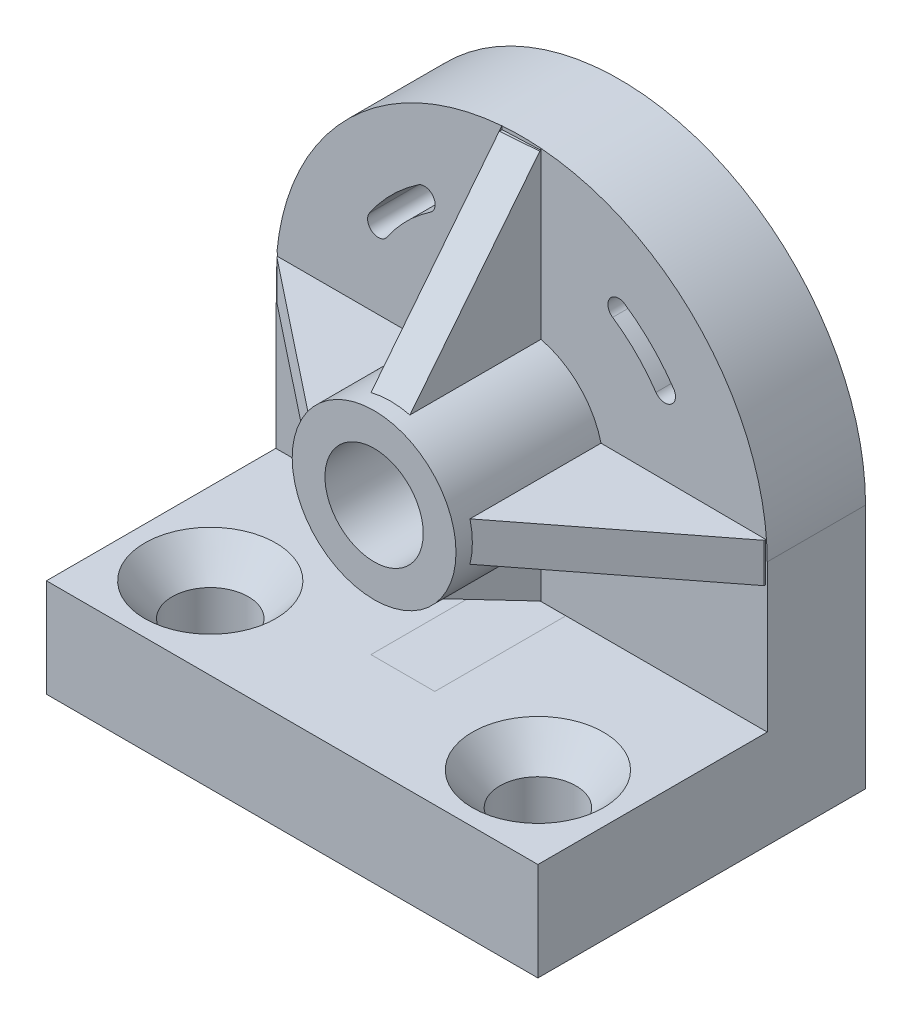
from build123d import *

# Parameters (mm, degrees)
SKETCH1_W           = 381
SKETCH1_H           = 254
BOSS_EXTRUDE1_DEPTH = 76.2
SKETCH2_R           = 50.8
CUT_EXTRUDE2_DEPTH  = 25.4
DRAFT12_ANGLE       = 40
SKETCH3_R           = 29.486869368
CUT_EXTRUDE3_DEPTH  = 58.42
BOSS_EXTRUDE2_DEPTH = 76.2
SKETCH8_R           = 63.5
SKETCH8_R_2         = 38.1
BOSS_EXTRUDE3_DEPTH = 114.3
BOSS_EXTRUDE5_DEPTH = 101.6
CUT_EXTRUDE5_DEPTH  = 45.72
CUT_EXTRUDE7_DEPTH  = 45.72
SKETCH14_W          = 30.414377964
SKETCH14_H          = 102.761189595
CUT_EXTRUDE8_DEPTH  = 2.54
CUT_EXTRUDE10_DEPTH = 113.538
CUT_EXTRUDE11_DEPTH = 49.53
SKETCH18_W          = 114.3
SKETCH18_H          = 34.366560293
CUT_EXTRUDE12_DEPTH = 1.27


with BuildPart() as part:
    # Sketch1 → Boss-Extrude1 (new body)
    with BuildSketch(Plane(origin=(0, 0, 0), x_dir=(1, 0, 0), z_dir=(0, 1, 0))):
        Rectangle(SKETCH1_W, SKETCH1_H)
    extrude(amount=BOSS_EXTRUDE1_DEPTH)

    # Sketch2 → Cut-Extrude2 (cut)
    with BuildSketch(Plane(origin=(0, 76.2, 0), x_dir=(1, 0, 0), z_dir=(0, 1, 0))):
        with Locations(Location((-127, -63.5, 0), (0, 0, 270))):
            Circle(SKETCH2_R)
        with Locations(Location((127, -63.5, 0), (0, 0, 270))):
            Circle(SKETCH2_R)
    extrude(amount=-CUT_EXTRUDE2_DEPTH, mode=Mode.SUBTRACT)

    # Draft12
    draft12_faces = [part.faces().sort_by_distance(p)[0] for p in [
        (127, 63.5, 12.7),
        (-127, 63.5, 12.7),
    ]]
    draft(draft12_faces, Plane.ZX.offset(76.2), DRAFT12_ANGLE)

    # Sketch3 → Cut-Extrude3 (cut)
    with BuildSketch(Plane(origin=(0, 50.8, 0), x_dir=(1, 0, 0), z_dir=(0, 1, 0))):
        with Locations(Location((-127, -63.5, 0), (0, 0, 270))):
            Circle(SKETCH3_R)
        with Locations(Location((127, -63.5, 0), (0, 0, 270))):
            Circle(SKETCH3_R)
    extrude(amount=-CUT_EXTRUDE3_DEPTH, mode=Mode.SUBTRACT)

    # Sketch7 → Boss-Extrude2 (add)
    with BuildSketch(Plane(origin=(0, 0, -127), x_dir=(-1, 0, 0), z_dir=(0, 0, -1))):
        with BuildLine():
            Line((-190.5, 190.5), (-190.5, 76.2))
            Line((-190.5, 76.2), (190.5, 76.2))
            Line((190.5, 76.2), (190.5, 190.5))
            ThreePointArc((190.5, 190.5), (0, 381), (-190.5, 190.5))
        make_face()
        with BuildLine():
            ThreePointArc((-117.932239005, 270.462329484), (-100.740317319, 291.263959826), (-79.934653291, 308.450999727))
            ThreePointArc((-79.934653291, 308.450999727), (-68.414615597, 306.23785422), (-70.627761104, 294.717816525))
            ThreePointArc((-70.627761104, 294.717816525), (-80.185406349, 287.556347183), (-89.021441012, 279.521441012))
            ThreePointArc((-89.021441012, 279.521441012), (-97.046938357, 270.696793423), (-104.201240138, 261.152214923))
            ThreePointArc((-104.201240138, 261.152214923), (-115.721796852, 258.94177277), (-117.932239005, 270.462329484))
        make_face(mode=Mode.SUBTRACT)
        with BuildLine():
            ThreePointArc((70.627761104, 294.717816525), (68.414615597, 306.23785422), (79.934653291, 308.450999727))
            ThreePointArc((79.934653291, 308.450999727), (100.740317319, 291.263959826), (117.932239005, 270.462329484))
            ThreePointArc((117.932239005, 270.462329484), (115.721796852, 258.94177277), (104.201240138, 261.152214923))
            ThreePointArc((104.201240138, 261.152214923), (89.010995509, 279.53188529), (70.627761104, 294.717816525))
        make_face(mode=Mode.SUBTRACT)
    extrude(amount=-BOSS_EXTRUDE2_DEPTH)

    # Sketch8 → Boss-Extrude3 (add)
    with BuildSketch(Plane.XY.offset(-50.8)):
        with Locations(Location((0, 190.5, 0), (0, 0, 180))):
            Circle(SKETCH8_R)
        with Locations((0, 190.5)):
            Circle(SKETCH8_R_2, mode=Mode.SUBTRACT)
    extrude(amount=BOSS_EXTRUDE3_DEPTH)

    # Sketch9 → Boss-Extrude5 (add)
    with BuildSketch(Plane.XY.offset(-50.8)):
        with BuildLine():
            ThreePointArc((-63.5, 190.5), (-63.034311995, 198.176295412), (-61.644078386, 205.74))
            Line((-61.644078386, 205.74), (-189.889421506, 205.74))
            ThreePointArc((-189.889421506, 205.74), (-190.347294172, 198.126113133), (-190.5, 190.5))
            Line((-190.5, 190.5), (-190.5, 175.26))
            Line((-190.5, 175.26), (-189.889421506, 175.26))
            Line((-189.889421506, 175.26), (-61.644078386, 175.26))
            ThreePointArc((-61.644078386, 175.26), (-63.034311995, 182.823704588), (-63.5, 190.5))
        make_face()
        with BuildLine():
            ThreePointArc((-15.082045068, 252.1829143), (-7.595556001, 253.544091944), (0, 254))
            ThreePointArc((0, 254), (7.595556001, 253.544091944), (15.082045068, 252.1829143))
            Line((15.082045068, 252.1829143), (15.24, 380.389421506))
            Line((15.24, 380.389421506), (0, 381))
            Line((0, 381), (-15.24, 380.389421506))
            Line((-15.24, 380.389421506), (-15.082045068, 252.1829143))
        make_face()
        with BuildLine():
            Line((189.950255379, 204.962035874), (61.644078386, 205.74))
            ThreePointArc((61.644078386, 205.74), (63.034311995, 198.176295412), (63.5, 190.5))
            ThreePointArc((63.5, 190.5), (63.034311995, 182.823704588), (61.644078386, 175.26))
            Line((61.644078386, 175.26), (190.5, 174.486230006))
            Line((190.5, 174.486230006), (190.5, 190.5))
            ThreePointArc((190.5, 190.5), (190.499180219, 191.058870317), (190.496720882, 191.617735823))
            Line((190.496720882, 191.617735823), (189.950255379, 204.962035874))
        make_face()
        with BuildLine():
            ThreePointArc((0, 127), (-7.595556001, 127.455908056), (-15.082045068, 128.8170857))
            Line((-15.082045068, 128.8170857), (-15.14687117, 76.2))
            Line((-15.14687117, 76.2), (15.14687117, 76.2))
            Line((15.14687117, 76.2), (15.082045068, 128.8170857))
            ThreePointArc((15.082045068, 128.8170857), (7.595556001, 127.455908056), (0, 127))
        make_face()
    extrude(amount=BOSS_EXTRUDE5_DEPTH)

    # Sketch12 → Cut-Extrude5 (cut)
    with BuildSketch(Plane(origin=(0, 205.74, 0), x_dir=(1, 0, 0), z_dir=(0, 1, 0))):
        Polygon((-189.889421506, 50.8), (-61.644078386, -50.8), (-189.889421506, -50.8), align=None)
        Polygon((61.644078386, -50.8), (189.939855134, 50.080996567), (189.939855134, -51.102730255), align=None)
    extrude(amount=-CUT_EXTRUDE5_DEPTH, mode=Mode.SUBTRACT)

    # Sketch13 → Cut-Extrude7 (cut)
    with BuildSketch(Plane(origin=(-14.771324414, -0.018198792, 0), x_dir=(0, 0, 1), z_dir=(-0.9999992410454731, -0.0012320342843575279, 0))):
        Polygon((49.976172144, 128.857586049), (-50.703977004, 76.513004093), (49.976172144, 76.513004093), align=None)
        Polygon((-50.8, 380.407909011), (50.8, 252.201304502), (50.8, 380.407909011), align=None)
    extrude(amount=-CUT_EXTRUDE7_DEPTH, mode=Mode.SUBTRACT)

    # Sketch14 → Cut-Extrude8 (cut)
    with BuildSketch(Plane(origin=(-15.24, 380.389421506, 0), x_dir=(0.999198394601935, 0.040032089939392876, 0), z_dir=(-0.040032089939392876, 0.999198394601935, 0))):
        with Locations((15.207188982, -0.580594797)):
            Rectangle(SKETCH14_W, SKETCH14_H)
    extrude(amount=-CUT_EXTRUDE8_DEPTH, mode=Mode.SUBTRACT)

    # Sketch16 → Cut-Extrude10 (cut)
    with BuildSketch(Plane.XY.offset(-50.8)):
        Polygon((193.250022217, 207.113042918), (189.330693969, 207.113042918), (189.330693969, 174.593579484), (189.330693969, 171.225607819), (193.250022217, 171.225607819), align=None)
    extrude(amount=CUT_EXTRUDE10_DEPTH, mode=Mode.SUBTRACT)

    # Sketch17 → Cut-Extrude11 (cut, symmetric)
    with BuildSketch(Plane(origin=(-15.24072912, 0.018777115, 0), x_dir=(0, 0, 1), z_dir=(-0.9999992410454731, 0.0012320342843575279, 0))):
        Polygon((-50.8, 76.181280703), (50.8, 128.798406337), (50.8, 76.181280703), align=None)
    extrude(amount=CUT_EXTRUDE11_DEPTH, both=True, mode=Mode.SUBTRACT)

    # Sketch18 → Cut-Extrude12 (cut, symmetric)
    with BuildSketch(Plane.ZY.offset(190.5)):
        with Locations((5.785260264, 190.980569653)):
            Rectangle(SKETCH18_W, SKETCH18_H)
    extrude(amount=CUT_EXTRUDE12_DEPTH, both=True, mode=Mode.SUBTRACT)


solid = part.part
